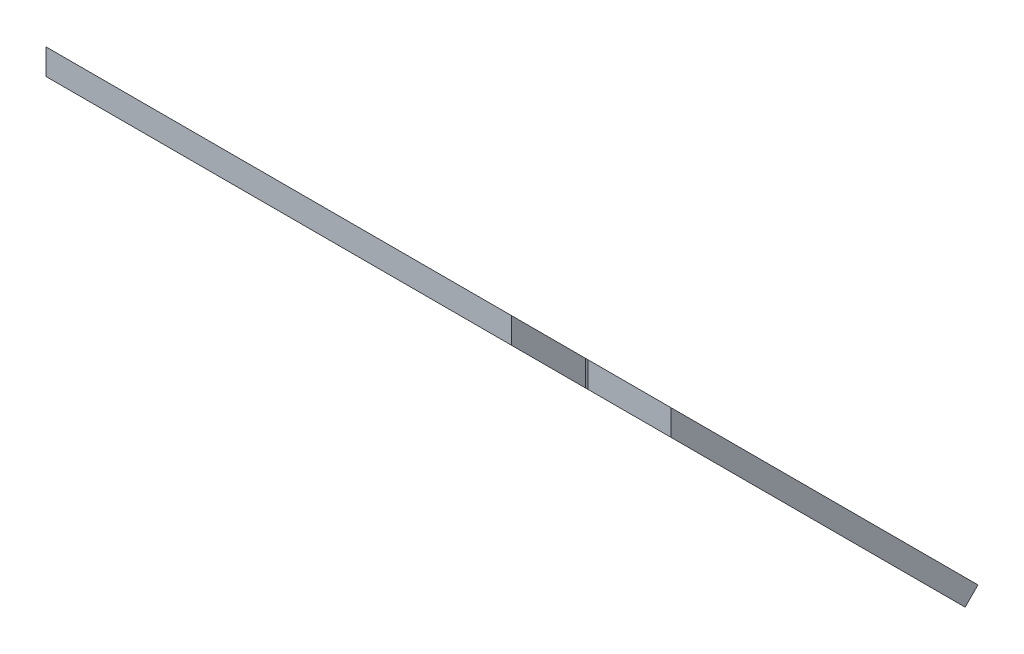
from build123d import *

# Parameters (mm, degrees)
SKETCH1_W           = 25.6032
SKETCH1_H           = 36.25342
SKETCH1_R           = 5.1
BOSS_EXTRUDE1_DEPTH = 1
CUT_EXTRUDE1_DEPTH  = 50.8


with BuildPart() as part:
    # Sketch1 → Boss-Extrude1 (new body)
    with BuildSketch(Plane(origin=(0, 0, 0), x_dir=(1, 0, 0), z_dir=(0, -0.7071067811865488, 0.7071067811865464))):
        with Locations((-15.465234019, -18.12671)):
            Rectangle(SKETCH1_W, SKETCH1_H)
        with Locations((-15.367622747, -27.2796)):
            Circle(SKETCH1_R, mode=Mode.SUBTRACT)
    extrude(amount=BOSS_EXTRUDE1_DEPTH)

    # Sketch2 → Cut-Extrude1 (cut)
    with BuildSketch(Plane(origin=(0, 0, 0), x_dir=(1, 0, 0), z_dir=(0, 1, 0))):
        Polygon((-2.663634019, 0), (-2.663634019, 4.06654), (-7.235634019, 4.06654), (-7.235634019, 8.76554), (-2.663634019, 8.76554), (3.686238972, 8.76554), (3.686238972, -11.022964716), (-35.05379443, -11.022964716), (-35.05379443, 8.76554), (-23.694834019, 8.76554), (-23.694834019, 4.06654), (-28.266834019, 4.06654), (-28.266834019, 0), align=None)
    extrude(amount=-CUT_EXTRUDE1_DEPTH, mode=Mode.SUBTRACT)


solid = part.part
